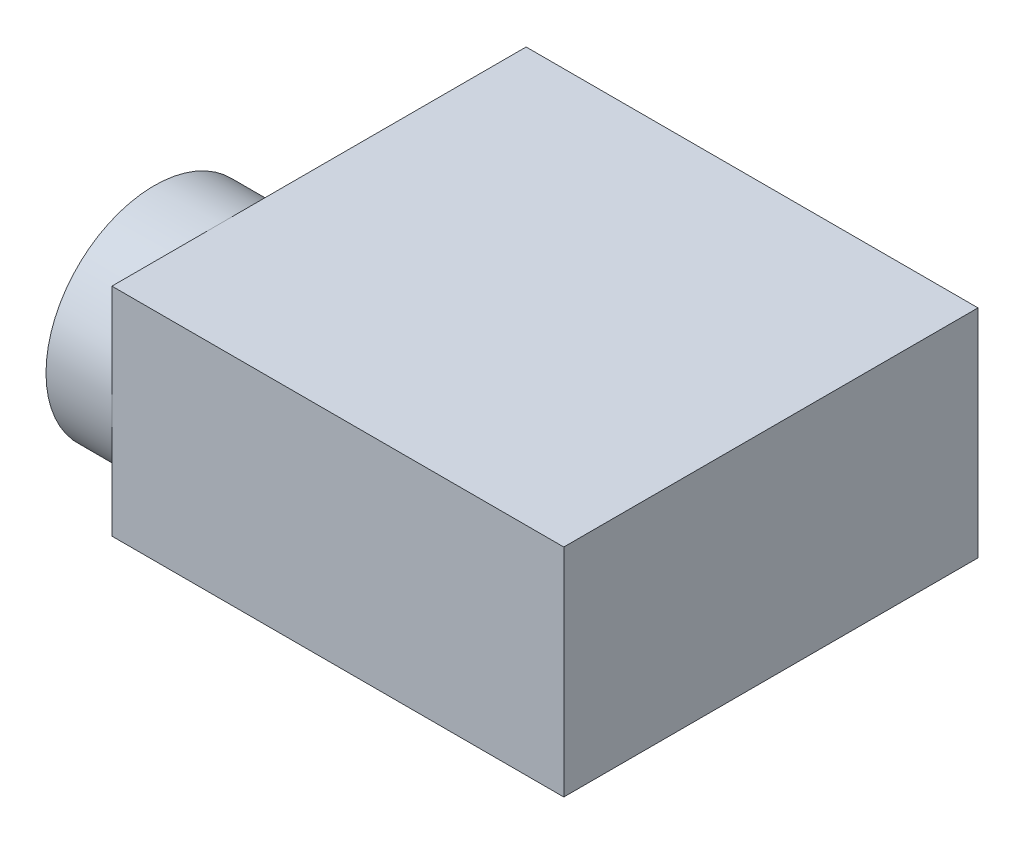
from build123d import *

# Parameters (mm, degrees)
BOSS_EXTRUDE1_DEPTH = 11.5
BOSS_EXTRUDE2_DEPTH = 3.5
SKETCH4_R           = 1.5
BOSS_EXTRUDE3_DEPTH = 3
SKETCH5_R           = 1.25
CUT_EXTRUDE1_DEPTH  = 3.5
SKETCH6_W           = 4
SKETCH6_H           = 11.5
CUT_EXTRUDE2_DEPTH  = 10
SKETCH7_W           = 4
SKETCH7_H           = 11.5
CUT_EXTRUDE3_DEPTH  = 10


with BuildPart() as part:
    # Sketch1 → Boss-Extrude1 (new body)
    with BuildSketch(Plane(origin=(0, 0, 0), x_dir=(1, 0, 0), z_dir=(0, 1, 0))):
        Polygon((-20, 0), (-24, 0), (-24, 22), (-20, 22), (-20, 26), (-18, 26), (-18, 22), (0, 22), (0, 0), (-18, 0), (-18, -4), (-20, -4), align=None)
    extrude(amount=BOSS_EXTRUDE1_DEPTH)

    # Sketch2 → Boss-Extrude2 (add)
    with BuildSketch(Plane.ZY.offset(24)):
        with BuildLine():
            ThreePointArc((-11.140964663, 3.75), (0, 5.75), (-11.140964663, 7.75))
            ThreePointArc((-11.140964663, 7.75), (-13.140964663, 5.75), (-11.140964663, 3.75))
        make_face()
    extrude(amount=BOSS_EXTRUDE2_DEPTH)

    # Sketch4 → Boss-Extrude3 (add)
    with BuildSketch(Plane.ZY.offset(27.5)):
        with Locations((-5.75, 5.75)):
            Circle(SKETCH4_R)
    extrude(amount=BOSS_EXTRUDE3_DEPTH)

    # Sketch5 → Cut-Extrude1 (cut)
    with BuildSketch(Plane.ZY.offset(20)):
        with Locations((-24.8, 5.75)):
            Circle(SKETCH5_R)
        with Locations((2.8, 5.75)):
            Circle(SKETCH5_R)
    extrude(amount=-CUT_EXTRUDE1_DEPTH, mode=Mode.SUBTRACT)

    # Sketch6 → Cut-Extrude2 (cut)
    with BuildSketch(Plane(origin=(-18, 0, 0), x_dir=(0, 0, -1), z_dir=(1, 0, 0))):
        with Locations((24, 5.75)):
            Rectangle(SKETCH6_W, SKETCH6_H)
    extrude(amount=-CUT_EXTRUDE2_DEPTH, mode=Mode.SUBTRACT)

    # Sketch7 → Cut-Extrude3 (cut)
    with BuildSketch(Plane(origin=(-18, 0, 0), x_dir=(0, 0, -1), z_dir=(1, 0, 0))):
        with Locations((-2, 5.75)):
            Rectangle(SKETCH7_W, SKETCH7_H)
    extrude(amount=-CUT_EXTRUDE3_DEPTH, mode=Mode.SUBTRACT)


solid = part.part
